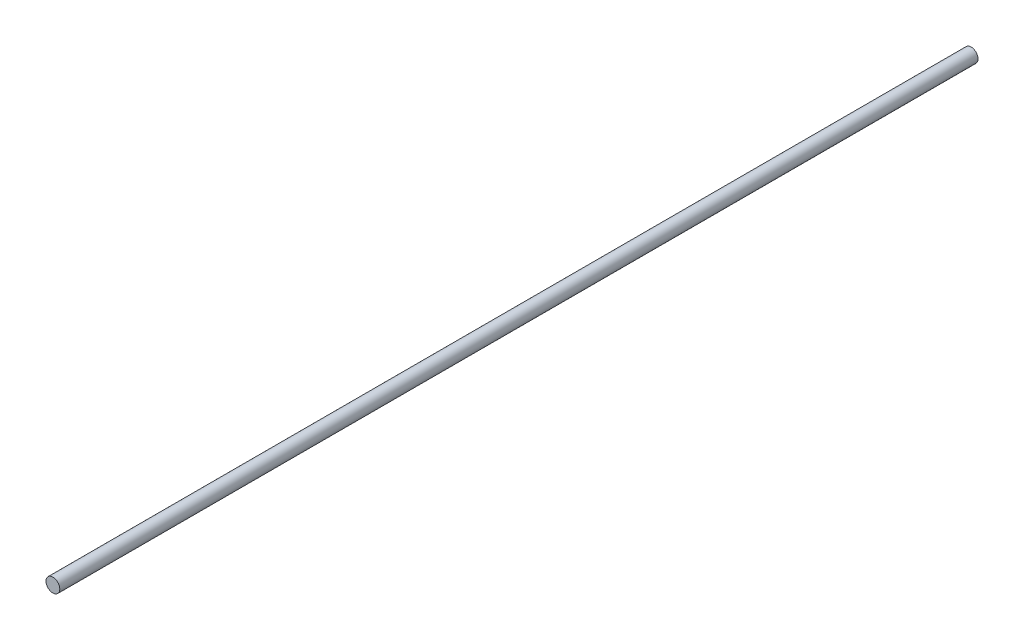
from build123d import *

# Parameters (mm, degrees)
SKETCH1_R           = 9.525
BOSS_EXTRUDE1_DEPTH = 1270


with BuildPart() as part:
    # Sketch1 → Boss-Extrude1 (new body)
    with BuildSketch(Plane.XY):
        with Locations(Location((0, 0, 0), (0, 0, 180))):
            Circle(SKETCH1_R)
    extrude(amount=BOSS_EXTRUDE1_DEPTH)


solid = part.part
